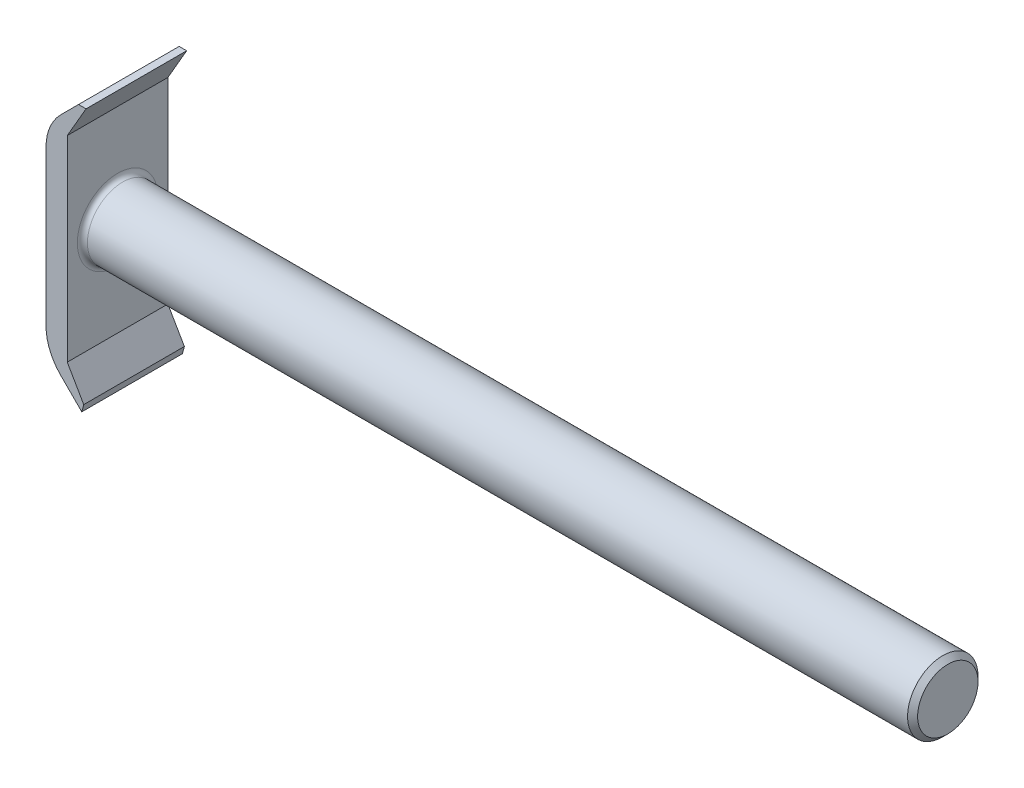
from build123d import *
from OCP.BRepFilletAPI import BRepFilletAPI_MakeChamfer

# Parameters (mm, degrees)
SZKIC1_R                         = 7
DODANIE_WYCI_GNI_CIE1_DEPTH      = 165
DODANIE_WYCI_GNI_CIE2_DEPTH      = 10
DODANIE_WYCI_GNI_CIE2_DEPTH_BACK = 10
SFAZOWANIE1_SIZE                 = 5
SFAZOWANIE1_SIZE2                = 4.082482905
SFAZOWANIE2_SIZE                 = 1
ZAOKR_GLENIE1_R                  = 10
ZAOKR_GLENIE2_R                  = 1


with BuildPart() as part:
    # Szkic1 → Dodanie-wyciągnięcie1 (new body)
    with BuildSketch(Plane(origin=(0, 0, 0), x_dir=(0, 0, -1), z_dir=(1, 0, 0))):
        Circle(SZKIC1_R)
    extrude(amount=DODANIE_WYCI_GNI_CIE1_DEPTH)

    # Szkic2 → Dodanie-wyciągnięcie2 (add, two sides: drawn at the far end of the back side and taken through both)
    with BuildSketch(Plane.XY.offset(-DODANIE_WYCI_GNI_CIE2_DEPTH_BACK)):
        Polygon((0, 0), (0, 19.5), (5.773502692, 29.5), (-4.226497308, 19.5), (-4.226497308, -19.5), (5.773502692, -29.5), (0, -19.5), align=None)
    extrude(amount=DODANIE_WYCI_GNI_CIE2_DEPTH + DODANIE_WYCI_GNI_CIE2_DEPTH_BACK)

    # Sfazowanie1: one chamfer whose edges measure the first distance from different faces: ONE call of the kernel's chamfer builder (chamfer() names one face for all edges)
    sfazowanie1_edges_1 = [part.edges().sort_by_distance(p)[0] for p in [
        (5.773502692, -29.5, 0),
    ]]
    sfazowanie1_side_1 = [part.faces().sort_by_distance(p)[0] for p in [
        (2.886751346, -24.5, 0),
    ]]
    sfazowanie1_edges_2 = [part.edges().sort_by_distance(p)[0] for p in [
        (5.773502692, 29.5, 0),
    ]]
    sfazowanie1_side_2 = [part.faces().sort_by_distance(p)[0] for p in [
        (0.773502692, 24.5, 0),
    ]]
    sfazowanie1 = BRepFilletAPI_MakeChamfer(part.part.solid().wrapped)
    for e in sfazowanie1_edges_1:
        sfazowanie1.Add(SFAZOWANIE1_SIZE, SFAZOWANIE1_SIZE2, e.wrapped, sfazowanie1_side_1[0].wrapped)  # the first distance lies on this face
    for e in sfazowanie1_edges_2:
        sfazowanie1.Add(SFAZOWANIE1_SIZE, SFAZOWANIE1_SIZE2, e.wrapped, sfazowanie1_side_2[0].wrapped)  # the first distance lies on this face
    add(Compound.cast(sfazowanie1.Shape()), mode=Mode.REPLACE)

    # Sfazowanie2
    sfazowanie2_edges = [part.edges().sort_by_distance(p)[0] for p in [
        (165, 0, 7),
    ]]
    chamfer(sfazowanie2_edges, length=SFAZOWANIE2_SIZE)

    # Zaokrąglenie1
    zaokr_glenie1_edges = [part.edges().sort_by_distance(p)[0] for p in [
        (-4.226497308, -19.5, 0),
        (-4.226497308, 19.5, 0),
    ]]
    fillet(zaokr_glenie1_edges, radius=ZAOKR_GLENIE1_R)

    # Zaokrąglenie2
    zaokr_glenie2_edges = [part.edges().sort_by_distance(p)[0] for p in [
        (0, 0, 7),
    ]]
    fillet(zaokr_glenie2_edges, radius=ZAOKR_GLENIE2_R)


solid = part.part
